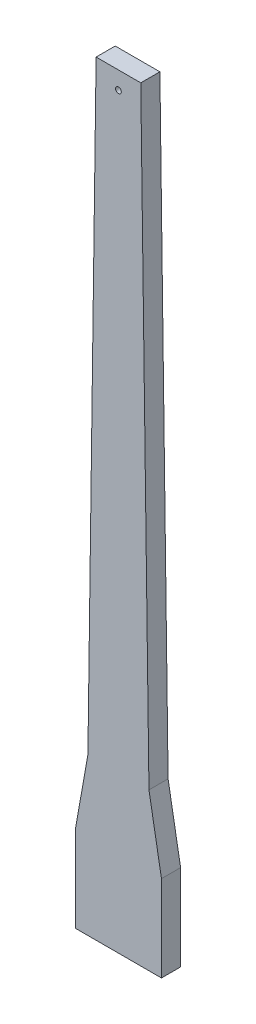
from build123d import *

# Parameters (mm, degrees)
SKETCH1_W           = 18
SKETCH1_H           = 4
BOSS_EXTRUDE1_DEPTH = 160
CUT_EXTRUDE1_DEPTH  = 160
SKETCH4_R           = 0.6
CUT_EXTRUDE2_DEPTH  = 160


with BuildPart() as part:
    # Sketch1 → Boss-Extrude1 (new body)
    with BuildSketch(Plane(origin=(0, 0, 0), x_dir=(1, 0, 0), z_dir=(0, 1, 0))):
        with Locations((-10.71526709, 13.305460186)):
            Rectangle(SKETCH1_W, SKETCH1_H)
    extrude(amount=BOSS_EXTRUDE1_DEPTH)

    # Sketch2 → Cut-Extrude1 (cut)
    with BuildSketch(Plane.XY):
        Polygon((-19.71526709, 18), (-19.71526709, 160), (-15.387039625, 160), (-17.100597756, 32.770358976), align=None)
        Polygon((-4.329936424, 32.770358976), (-6.043494554, 160), (-1.71526709, 160), (-1.71526709, 18), align=None)
    extrude(amount=-CUT_EXTRUDE1_DEPTH, mode=Mode.SUBTRACT)

    # Sketch4 → Cut-Extrude2 (cut)
    with BuildSketch(Plane.XY):
        with Locations((-10.71526709, 156.318807469)):
            Circle(SKETCH4_R)
    extrude(amount=-CUT_EXTRUDE2_DEPTH, mode=Mode.SUBTRACT)


solid = part.part
